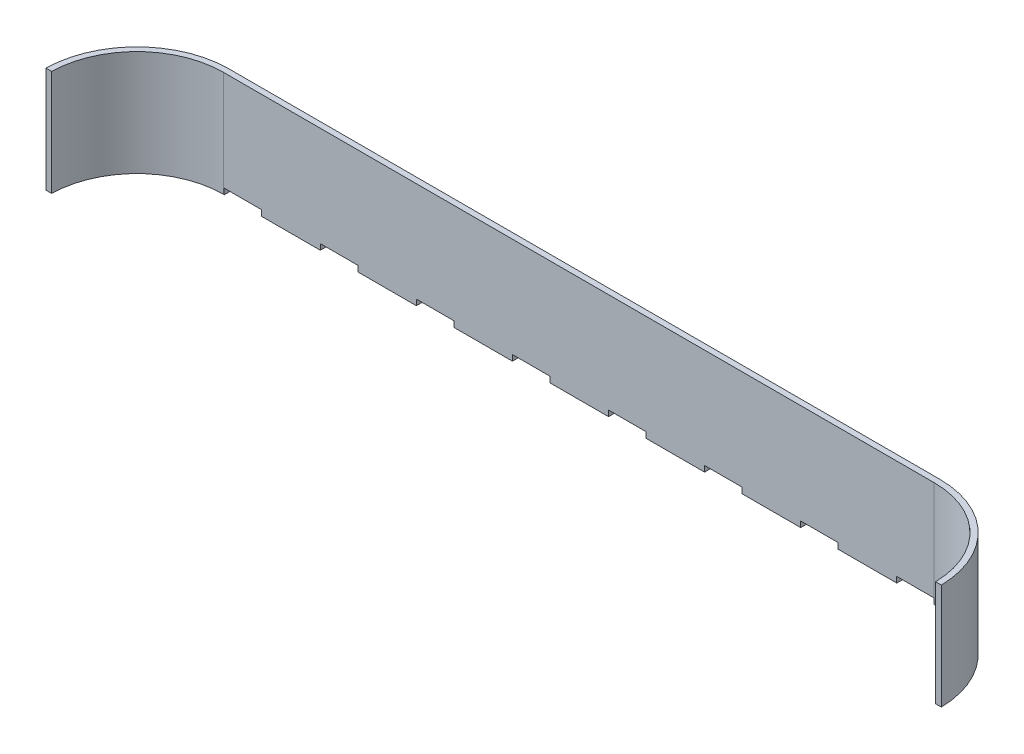
from build123d import *

# Parameters (mm, degrees)
BOSS_EXTRUDE4_DEPTH = 27.5
SKETCH2_W           = 19.5
SKETCH2_H           = 3
CUT_EXTRUDE1_DEPTH  = 240.335089361


with BuildPart() as part:
    # Sketch1 → Boss-Extrude4 (new, symmetric)
    with BuildSketch(Plane(origin=(0, 0, 0), x_dir=(1, 0, 0), z_dir=(0, 1, 0))):
        with BuildLine():
            Line((-185, 0), (185, 0))
            ThreePointArc((185, 0), (216.576404427, -12.938641896), (229.994773776, -44.314191845))
            Line((229.994773776, -44.314191845), (232.994425361, -44.268471301))
            ThreePointArc((232.994425361, -44.268471301), (218.681498055, -10.801218022), (185, 3))
            Line((185, 3), (-185, 3))
            ThreePointArc((-185, 3), (-218.681498055, -10.801218022), (-232.994425361, -44.268471301))
            Line((-232.994425361, -44.268471301), (-229.994773776, -44.314191845))
            ThreePointArc((-229.994773776, -44.314191845), (-216.576404427, -12.938641896), (-185, 0))
        make_face()
    extrude(amount=BOSS_EXTRUDE4_DEPTH, both=True)

    # Sketch2 → Cut-Extrude1 (cut, through all)
    with BuildSketch(Plane(origin=(0, 0, -3), x_dir=(-1, 0, 0), z_dir=(0, 0, -1))):
        with Locations((-125.25, -26)):
            Rectangle(SKETCH2_W, SKETCH2_H)
        with Locations((-175.25, -26)):
            Rectangle(SKETCH2_W, SKETCH2_H)
        with Locations((-75.25, -26)):
            Rectangle(SKETCH2_W, SKETCH2_H)
        with Locations((-25.25, -26)):
            Rectangle(SKETCH2_W, SKETCH2_H)
        with Locations((24.75, -26)):
            Rectangle(SKETCH2_W, SKETCH2_H)
        with Locations((74.75, -26)):
            Rectangle(SKETCH2_W, SKETCH2_H)
        with Locations((124.75, -26)):
            Rectangle(SKETCH2_W, SKETCH2_H)
        with Locations((174.75, -26)):
            Rectangle(SKETCH2_W, SKETCH2_H)
    extrude(amount=-CUT_EXTRUDE1_DEPTH, mode=Mode.SUBTRACT)


solid = part.part
